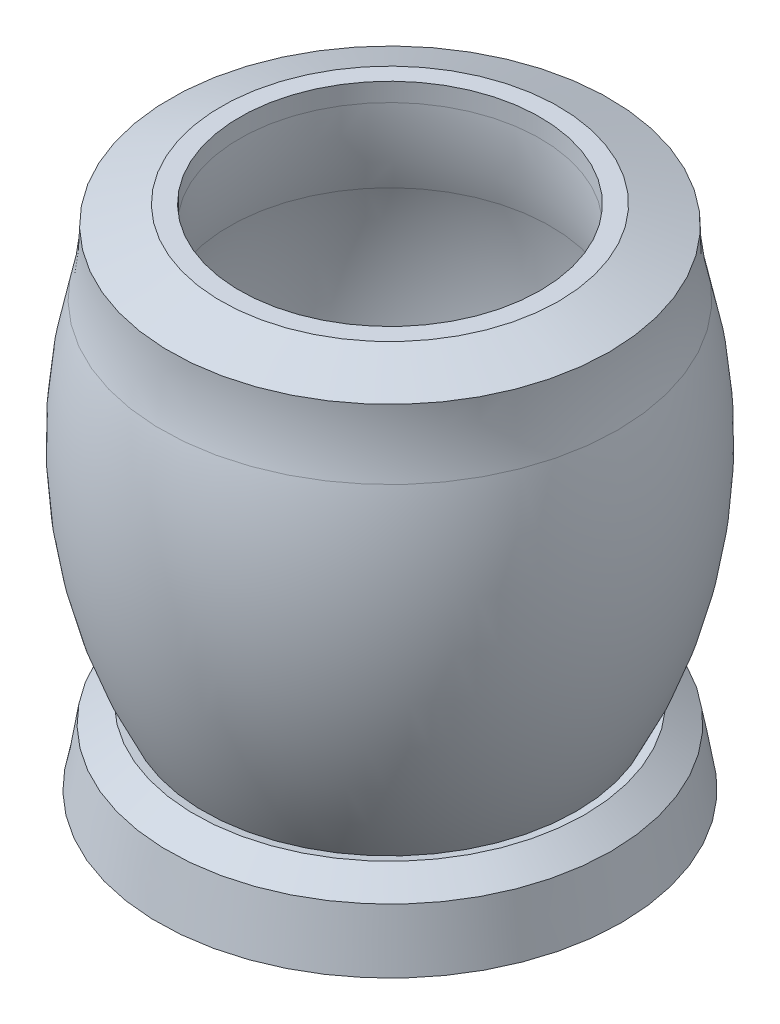
from build123d import *


with BuildPart() as part:
    # Sketch1 → Revolve1 (revolve)
    with BuildSketch(Plane.XY, mode=Mode.PRIVATE) as revolve1_sk:
        with BuildLine():
            Line((-3.937, 6.880739389), (-3.937, 0))
            Line((-3.937, 0), (-12.319, 0))
            Line((-12.319, 0), (-11.783931251, 3.034525669))
            Line((-11.783931251, 3.034525669), (-10.378276575, 4.018775669))
            Line((-10.378276575, 4.018775669), (-9.914503712, 3.937))
            ThreePointArc((-9.914503712, 3.937), (-12.774986685, 13.072695411), (-12.122652106, 22.623493969))
            ThreePointArc((-12.122652106, 22.623493969), (-11.798191929, 24.305948687), (-11.68945465, 26.01595))
            Line((-11.68945465, 26.01595), (-8.98525, 27.0002))
            Line((-8.98525, 27.0002), (-8.001, 27.0002))
            Line((-8.001, 27.0002), (-8.001, 26.01595))
            ThreePointArc((-8.001, 26.01595), (-8.139446135, 23.838747534), (-8.552554296, 21.696617855))
            ThreePointArc((-8.552554296, 21.696617855), (-9.208525617, 14.522239239), (-7.534619557, 7.515096784))
            Line((-7.534619557, 7.515096784), (-3.937, 6.880739389))
        make_face()
    revolve(revolve1_sk.sketch.rotate(Axis((0, 0, 0), (0, 1, 0)), 180), axis=Axis((0, 0, 0), (0, 1, 0)))


solid = part.part
